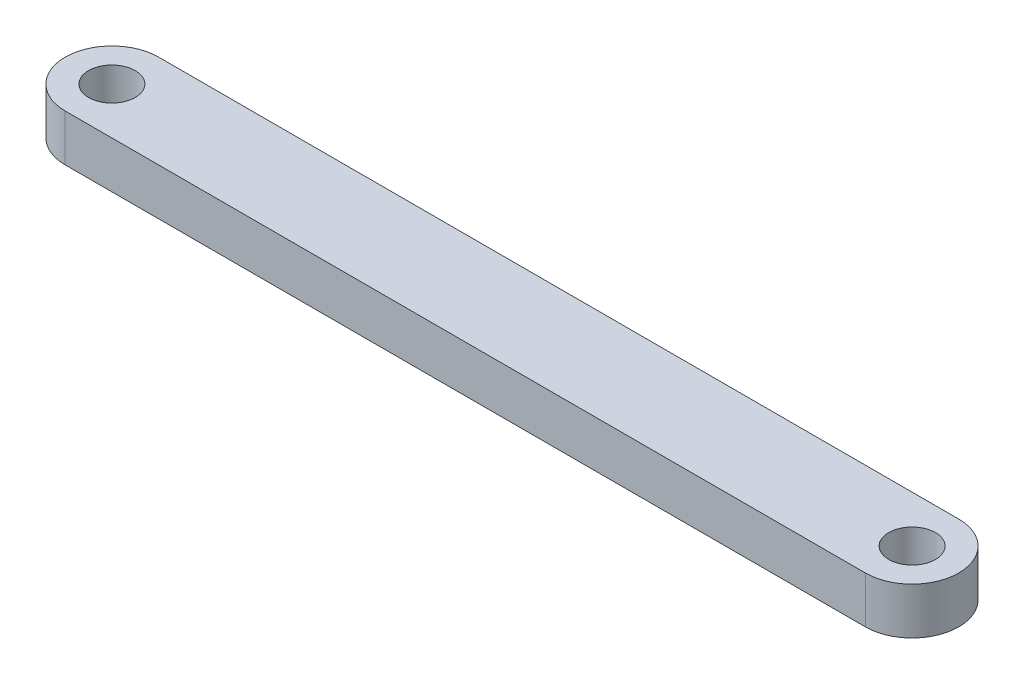
from build123d import *

# Parameters (mm, degrees)
SKETCH_1_R      = 1
EXTRUDE_1_DEPTH = 2


with BuildPart() as part:
    # 草图1 → 凸台-拉伸1 (new body)
    with BuildSketch(Plane(origin=(0, 0, 0), x_dir=(1, 0, 0), z_dir=(0, 1, 0))):
        with BuildLine():
            Line((-17.14, 2), (17.14, 2))
            ThreePointArc((17.14, 2), (19.14, 0), (17.14, -2))
            Line((17.14, -2), (-17.14, -2))
            ThreePointArc((-17.14, -2), (-19.14, 0), (-17.14, 2))
        make_face()
        with Locations(Location((-17.14, 0, 0), (0, 0, 270))):
            Circle(SKETCH_1_R, mode=Mode.SUBTRACT)
        with Locations(Location((17.14, 0, 0), (0, 0, 270))):
            Circle(SKETCH_1_R, mode=Mode.SUBTRACT)
    extrude(amount=EXTRUDE_1_DEPTH)


solid = part.part
